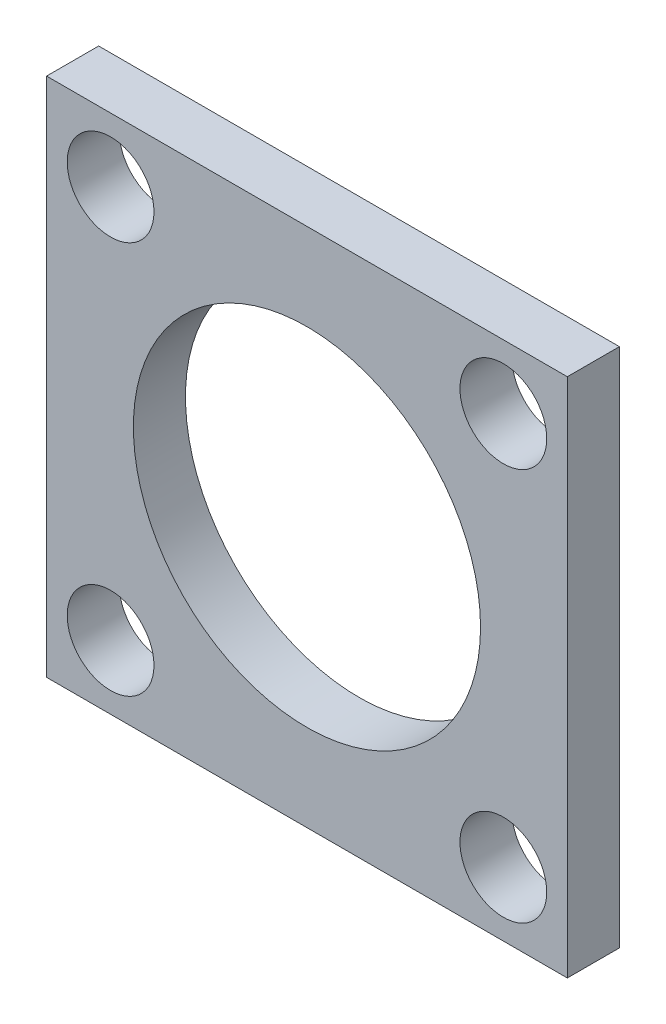
from build123d import *

# Parameters (mm, degrees)
SKETCH1_W           = 30
SKETCH1_H           = 30
BOSS_EXTRUDE1_DEPTH = 3
SKETCH2_R           = 10
CUT_EXTRUDE1_DEPTH  = 3
SKETCH3_R           = 2.5
CUT_EXTRUDE2_DEPTH  = 10


with BuildPart() as part:
    # Sketch1 → Boss-Extrude1 (new body)
    with BuildSketch(Plane.XY):
        Rectangle(SKETCH1_W, SKETCH1_H)
    extrude(amount=BOSS_EXTRUDE1_DEPTH)

    # Sketch2 → Cut-Extrude1 (cut)
    with BuildSketch(Plane.XY.offset(3)):
        Circle(SKETCH2_R)
    extrude(amount=-CUT_EXTRUDE1_DEPTH, mode=Mode.SUBTRACT)

    # Sketch3 → Cut-Extrude2 (cut)
    with BuildSketch(Plane.XY.offset(3)):
        with Locations((-11.313708499, 11.313708499)):
            Circle(SKETCH3_R)
        with Locations((11.313708499, 11.313708499)):
            Circle(SKETCH3_R)
        with Locations((11.313708499, -11.313708499)):
            Circle(SKETCH3_R)
        with Locations((-11.313708499, -11.313708499)):
            Circle(SKETCH3_R)
    extrude(amount=-CUT_EXTRUDE2_DEPTH, mode=Mode.SUBTRACT)


solid = part.part
